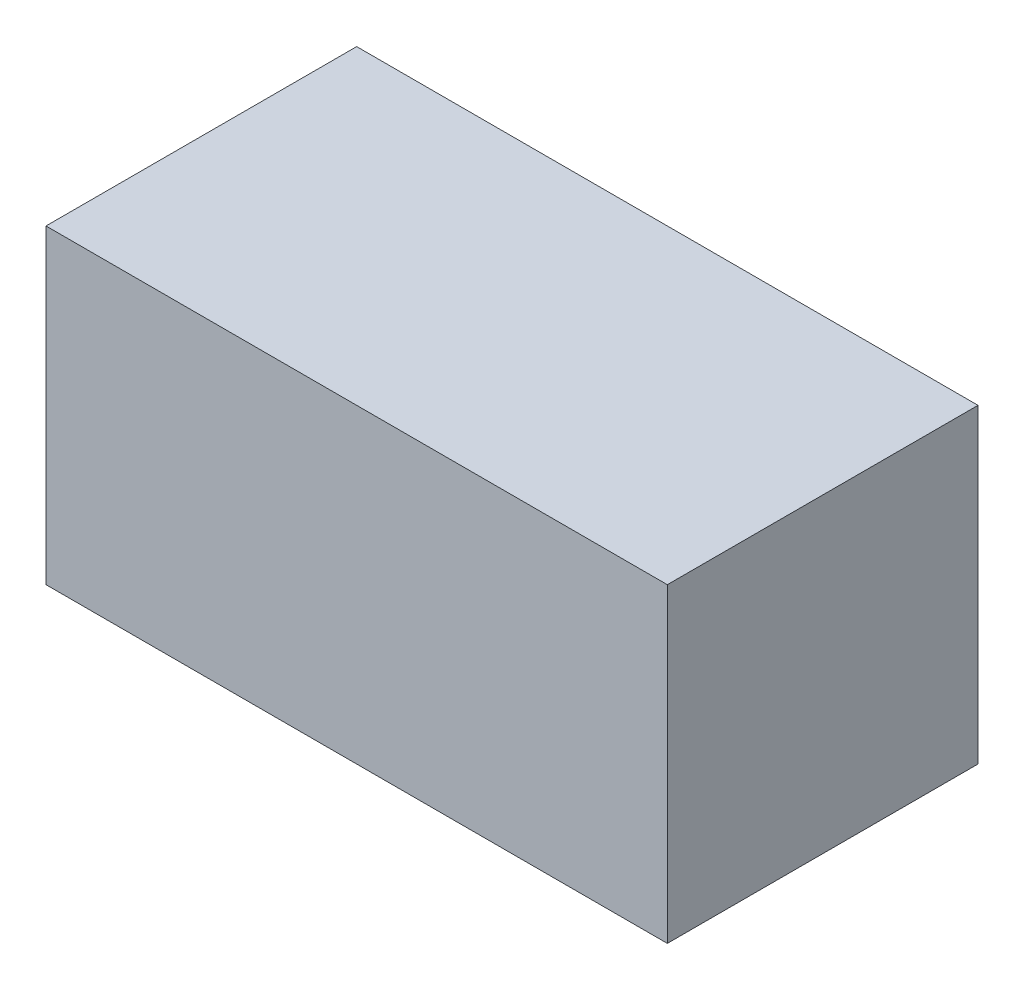
from build123d import *

# Parameters (mm, degrees)
BOSS_EXTRUDE1_START = -5
SKETCH1_W           = 20
SKETCH1_H           = 10
BOSS_EXTRUDE1_DEPTH = 10


with BuildPart() as part:
    # Sketch1 → Boss-Extrude1 (new body)
    with BuildSketch(Plane.XY.offset(BOSS_EXTRUDE1_START)):
        with Locations((10, 5)):
            Rectangle(SKETCH1_W, SKETCH1_H)
    extrude(amount=BOSS_EXTRUDE1_DEPTH)


solid = part.part
